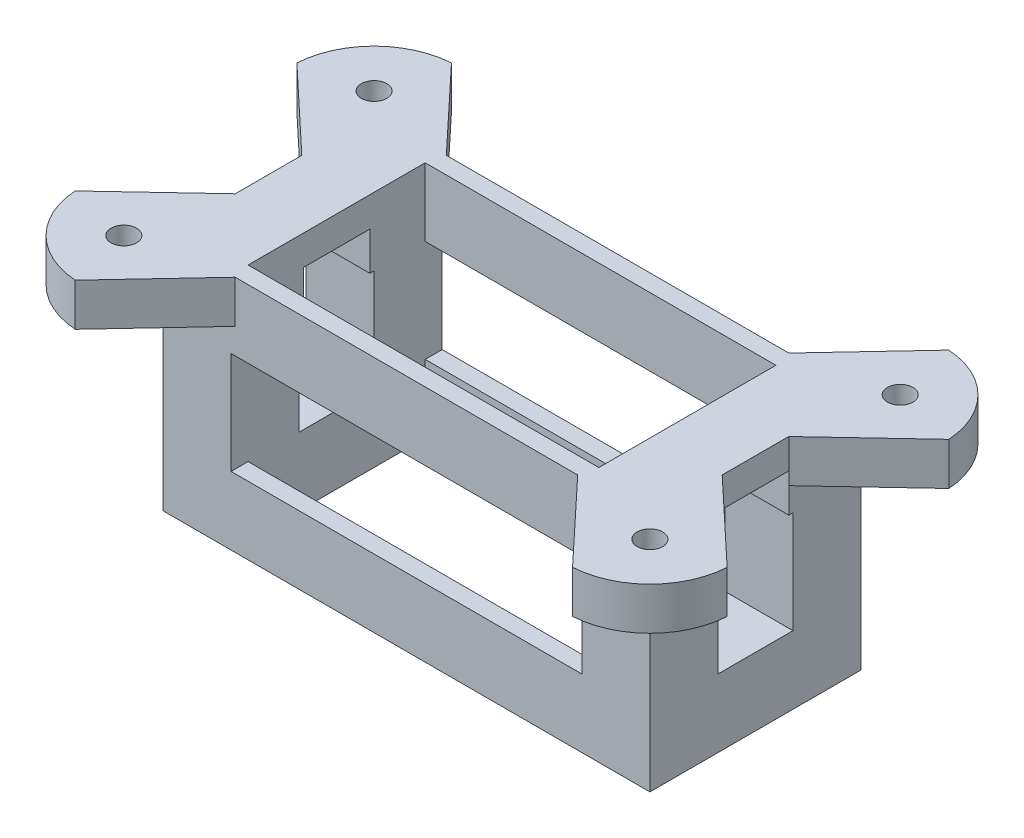
from build123d import *

# Parameters (mm, degrees)
SKETCH2_W               = 57.2
SKETCH2_H               = 24.8
SKETCH2_W_2             = 41.2
SKETCH2_H_2             = 20.8
BOSS_EXTRUDE2_DEPTH     = 28
SKETCH4_W               = 8.8
SKETCH4_H               = 12
CUT_EXTRUDE1_DEPTH      = 73
SKETCH5_W               = 41.2
SKETCH5_H               = 12
CUT_EXTRUDE2_DEPTH      = 28
SKETCH6_R               = 1.25
CUT_EXTRUDE3_DEPTH      = 7
SKETCH7_R               = 1.5
BOSS_EXTRUDE3_DEPTH     = 5
MIRROR2_COPY_1_SKETCH_R = 1.5
MIRROR2_COPY_1_DEPTH    = 5
BOSS_EXTRUDE4_START     = -5
BOSS_EXTRUDE4_DEPTH     = 5
MIRROR4_START           = -5
MIRROR4_COPY_1_DEPTH    = 5
CUT_EXTRUDE4_DEPTH      = 80.302431776


with BuildPart() as part:
    # Sketch2 → Boss-Extrude2 (new body)
    with BuildSketch(Plane.XZ):
        with Locations((0, -10)):
            Rectangle(SKETCH2_W, SKETCH2_H)
        with Locations((0, -10)):
            Rectangle(SKETCH2_W_2, SKETCH2_H_2, mode=Mode.SUBTRACT)
    extrude(amount=BOSS_EXTRUDE2_DEPTH)

    # Sketch4 → Cut-Extrude1 (cut)
    with BuildSketch(Plane.ZY.offset(28.6)):
        with Locations((-10, -14)):
            Rectangle(SKETCH4_W, SKETCH4_H)
    extrude(amount=-CUT_EXTRUDE1_DEPTH, mode=Mode.SUBTRACT)

    # Sketch5 → Cut-Extrude2 (cut)
    with BuildSketch(Plane.XY.offset(2.4)):
        with Locations((0, -14)):
            Rectangle(SKETCH5_W, SKETCH5_H)
    extrude(amount=-CUT_EXTRUDE2_DEPTH, mode=Mode.SUBTRACT)

    # Sketch6 → Cut-Extrude3 (cut)
    with BuildSketch(Plane.XZ.offset(28)):
        with Locations((-24.929249083, -15.5)):
            Circle(SKETCH6_R)
        with Locations((-24.929249083, -4.5)):
            Circle(SKETCH6_R)
        with Locations((24.929249083, -15.5)):
            Circle(SKETCH6_R)
        with Locations((24.929249083, -4.5)):
            Circle(SKETCH6_R)
    extrude(amount=-CUT_EXTRUDE3_DEPTH, mode=Mode.SUBTRACT)

    # Sketch7 → Boss-Extrude3 (add)
    with BuildSketch(Plane(origin=(0, 0, 0), x_dir=(1, 0, 0), z_dir=(0, 1, 0))):
        with BuildLine():
            Line((-28.6, -2.4), (-28.6, 0.6))
            Line((-28.6, 0.6), (-33.943490451, -4.423862881))
            ThreePointArc((-33.943490451, -4.423862881), (-32.636549964, -6.444153255), (-30.613803719, -7.74728957))
            Line((-30.613803719, -7.74728957), (-25.6, -2.4))
            Line((-25.6, -2.4), (-28.6, -2.4))
        make_face()
        with Locations(Location((-30.9, -4.7, 0), (0, 0, 180))):
            Circle(SKETCH7_R, mode=Mode.SUBTRACT)
    boss_extrude3 = extrude(amount=-BOSS_EXTRUDE3_DEPTH)

    # Mirror1: Boss-Extrude3 across plane
    add(boss_extrude3.mirror(Plane.ZY))

    # Mirror2: Boss-Extrude3 across plane
    add(boss_extrude3.mirror(Plane.XY.offset(-10)))

    # Mirror2 copy 1 sketch → Mirror2 copy 1 (add)
    with BuildSketch(Plane(origin=(0, 0, -20), x_dir=(-1, 0, 0), z_dir=(0, 1, 0))):
        with BuildLine():
            Line((-28.6, -2.4), (-28.6, 0.6))
            Line((-28.6, 0.6), (-33.943490451, -4.423862881))
            ThreePointArc((-33.943490451, -4.423862881), (-32.636549964, -6.444153255), (-30.613803719, -7.74728957))
            Line((-30.613803719, -7.74728957), (-25.6, -2.4))
            Line((-25.6, -2.4), (-28.6, -2.4))
        make_face()
        with Locations(Location((-30.9, -4.7, 0), (0, 0, 180))):
            Circle(MIRROR2_COPY_1_SKETCH_R, mode=Mode.SUBTRACT)
    extrude(amount=-MIRROR2_COPY_1_DEPTH)

    # Sketch8 → Boss-Extrude4 (add)
    with BuildSketch(Plane.XZ.offset(5).offset(BOSS_EXTRUDE4_START)):
        with BuildLine():
            Line((28.6, -0.6), (28.6, -6.090275739))
            Line((28.6, -6.090275739), (38.293875859, 3.023748801))
            ThreePointArc((38.293875859, 3.023748801), (35.462849129, 9.2747068), (29.207013206, 12.0949382))
            Line((29.207013206, 12.0949382), (20.116703701, 2.4))
            Line((20.116703701, 2.4), (25.6, 2.4))
            Line((25.6, 2.4), (30.613803719, 7.74728957))
            ThreePointArc((30.613803719, 7.74728957), (32.636549964, 6.444153255), (33.943490451, 4.423862881))
            Line((33.943490451, 4.423862881), (28.6, -0.6))
        make_face()
    boss_extrude4 = extrude(amount=BOSS_EXTRUDE4_DEPTH)

    # Mirror3: Boss-Extrude4 across plane
    add(boss_extrude4.mirror(Plane(origin=(0, 0, -10), x_dir=(1, 0, 0), z_dir=(0, 0, -1))))

    # Mirror4: Boss-Extrude4 across plane
    add(boss_extrude4.mirror(Plane.ZY))

    # Mirror4 copy 1 sketch → Mirror4 copy 1 (add)
    with BuildSketch(Plane(origin=(0, -5, -20), x_dir=(-1, 0, 0), z_dir=(0, -1, 0)).offset(MIRROR4_START)):
        with BuildLine():
            Line((28.6, -0.6), (28.6, -6.090275739))
            Line((28.6, -6.090275739), (38.293875859, 3.023748801))
            ThreePointArc((38.293875859, 3.023748801), (35.462849129, 9.2747068), (29.207013206, 12.0949382))
            Line((29.207013206, 12.0949382), (20.116703701, 2.4))
            Line((20.116703701, 2.4), (25.6, 2.4))
            Line((25.6, 2.4), (30.613803719, 7.74728957))
            ThreePointArc((30.613803719, 7.74728957), (32.636549964, 6.444153255), (33.943490451, 4.423862881))
            Line((33.943490451, 4.423862881), (28.6, -0.6))
        make_face()
    extrude(amount=MIRROR4_COPY_1_DEPTH)

    # Sketch10 → Cut-Extrude4 (cut, through all)
    with BuildSketch(Plane(origin=(28.6, 0, 0), x_dir=(0, 0, -1), z_dir=(1, 0, 0))):
        Polygon((13.909724261, -5), (13.909724261, -3.5), (10, -3.5), (6.090275739, -3.5), (6.090275739, -5), (6.090275739, -8), (13.909724261, -8), align=None)
    extrude(amount=-CUT_EXTRUDE4_DEPTH, mode=Mode.SUBTRACT)


solid = part.part
